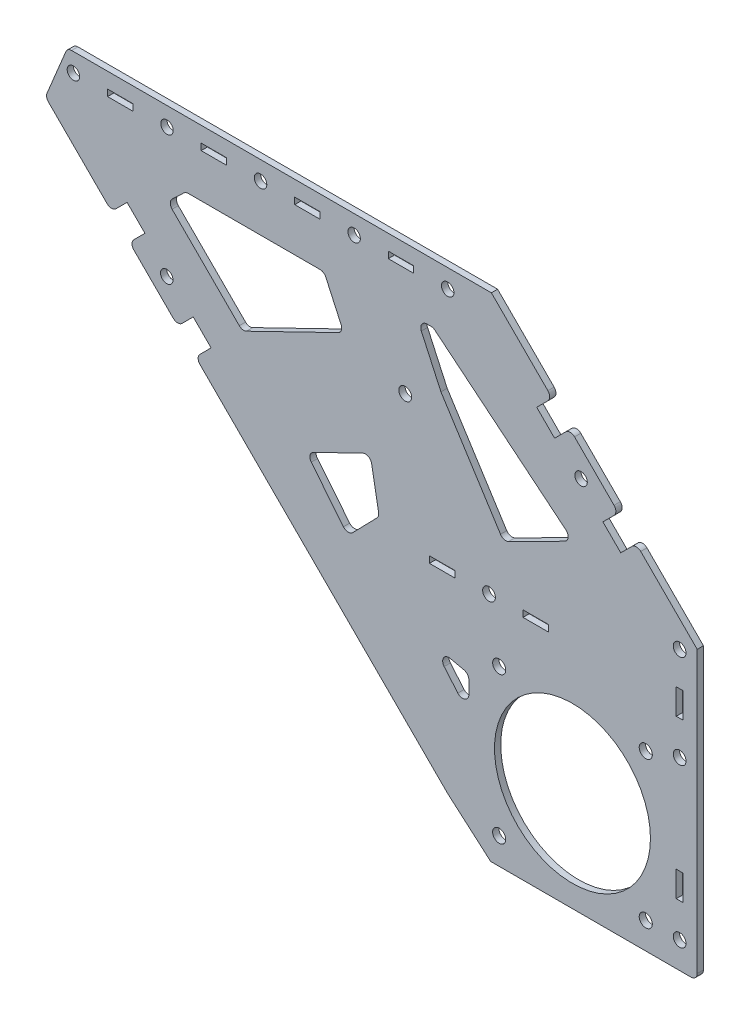
from build123d import *

# Parameters (mm, degrees)
SKETCH_1_R      = 2
SKETCH_1_R_2    = 25
SKETCH_1_R_3    = 2.05
SKETCH_1_R_4    = 2.1
SKETCH_1_W      = 8.1
SKETCH_1_H      = 2.1
SKETCH_1_W_2    = 8.2
SKETCH_1_W_3    = 2.2
SKETCH_1_H_2    = 8.2
EXTRUDE_1_DEPTH = 2
FILLET_2_R      = 2


with BuildPart() as part:
    # 草图1 → 凸台-拉伸1 (new body)
    with BuildSketch(Plane.XY):
        Polygon((7.027428163, -4.999036262), (20.810808237, -16.956988843), (73.227648339, -16.964389058), (87.027428163, -16.964389058), (87.027428163, 75.054738201), (67.497807203, 94.584359161), (63.997628636, 91.084180595), (62.512704395, 89.599256354), (56.785139468, 95.326821282), (58.270063708, 96.811745522), (61.771734574, 100.31043179), (54.027428163, 108.054738201), (46.284614051, 115.797552313), (42.784435485, 112.297373746), (41.299511244, 110.812449505), (35.571946316, 116.540014433), (37.056870557, 118.024938674), (40.557049124, 121.52511724), (21.027428163, 141.054738201), (-114.884210676, 141.054738201), (-121.955278488, 123.983670389), (-100.755816342, 102.784208243), (-97.257364322, 106.282660262), (-95.772440082, 107.767584503), (-90.044875154, 102.040019575), (-91.529799395, 100.555095335), (-95.028251414, 97.056643315), (-87.28543216, 89.313824061), (-79.542612906, 81.571004807), (-76.044160887, 85.069456827), (-74.559236646, 86.554381067), (-68.831671719, 80.82681614), (-70.316595959, 79.341891899), (-73.815047978, 75.84343988), align=None)
        with Locations((-52.972571837, 135.054738201)):
            Circle(SKETCH_1_R, mode=Mode.SUBTRACT)
        with Locations((47.027428163, 15.054738201)):
            Circle(SKETCH_1_R_2, mode=Mode.SUBTRACT)
        with Locations(Location((-22.972571837, 135.054738201, 0), (0, 0, 180))):
            Circle(SKETCH_1_R, mode=Mode.SUBTRACT)
        with Locations((7.027428163, 135.054738201)):
            Circle(SKETCH_1_R, mode=Mode.SUBTRACT)
        with Locations(Location((-112.972571837, 135.054738201, 0), (0, 0, 180))):
            Circle(SKETCH_1_R, mode=Mode.SUBTRACT)
        with Locations((-82.972571837, 135.054738201)):
            Circle(SKETCH_1_R, mode=Mode.SUBTRACT)
        with Locations((49.784787476, 103.812097514)):
            Circle(SKETCH_1_R, mode=Mode.SUBTRACT)
        with Locations((-83.04451802, 93.554738201)):
            Circle(SKETCH_1_R, mode=Mode.SUBTRACT)
        with Locations((20.275835807, 57.054738201)):
            Circle(SKETCH_1_R_3, mode=Mode.SUBTRACT)
        with Locations((-6.58531727, 99.226748532)):
            Circle(SKETCH_1_R_3, mode=Mode.SUBTRACT)
        with Locations((70.527428163, -8.445261799)):
            Circle(SKETCH_1_R_4, mode=Mode.SUBTRACT)
        with Locations((23.527428163, -8.445261799)):
            Circle(SKETCH_1_R_4, mode=Mode.SUBTRACT)
        with Locations((23.527428163, 38.554738201)):
            Circle(SKETCH_1_R_4, mode=Mode.SUBTRACT)
        with Locations((70.527428163, 38.554738201)):
            Circle(SKETCH_1_R_4, mode=Mode.SUBTRACT)
        with Locations((81.392055944, 72.204829046)):
            Circle(SKETCH_1_R_3, mode=Mode.SUBTRACT)
        with Locations((81.392055944, -8.445261799)):
            Circle(SKETCH_1_R_3, mode=Mode.SUBTRACT)
        with Locations((81.392055944, 42.204829046)):
            Circle(SKETCH_1_R_3, mode=Mode.SUBTRACT)
        with Locations((-37.972571837, 135.054738201)):
            Rectangle(SKETCH_1_W, SKETCH_1_H, mode=Mode.SUBTRACT)
        with Locations((-7.972571837, 135.054738201)):
            Rectangle(SKETCH_1_W, SKETCH_1_H, mode=Mode.SUBTRACT)
        with Locations((-97.972571837, 135.054738201)):
            Rectangle(SKETCH_1_W, SKETCH_1_H, mode=Mode.SUBTRACT)
        with Locations((-67.972571837, 135.054738201)):
            Rectangle(SKETCH_1_W, SKETCH_1_H, mode=Mode.SUBTRACT)
        with Locations((5.275835807, 57.054738201)):
            Rectangle(SKETCH_1_W_2, SKETCH_1_H, mode=Mode.SUBTRACT)
        with Locations((35.275835807, 57.054738201)):
            Rectangle(SKETCH_1_W_2, SKETCH_1_H, mode=Mode.SUBTRACT)
        Polygon((-26.317798475, 106.3059132), (-58.783300448, 90.506724064), (-82.786741677, 114.510165293), (-76.96930946, 120.054738201), (-32.606331473, 120.054738201), align=None, mode=Mode.SUBTRACT)
        Polygon((47.299709176, 85.219712632), (24.92619293, 73.952191934), (4.862626833, 105.451990707), (-2.731253041, 122.054738201), (2.37892986, 122.054738201), align=None, mode=Mode.SUBTRACT)
        Polygon((-14.950211349, 60.939664471), (-17.845757969, 77.065019133), (-38.30861977, 67.106860342), (-24.982934729, 50.626518371), align=None, mode=Mode.SUBTRACT)
        Polygon((2.01437662, 34.262984309), (13.802642778, 20.368597473), (13.802642778, 31.594822975), align=None, mode=Mode.SUBTRACT)
        with Locations((81.392055944, 57.204829046)):
            Rectangle(SKETCH_1_W_3, SKETCH_1_H_2, mode=Mode.SUBTRACT)
        with Locations((81.392055944, 6.554738201)):
            Rectangle(SKETCH_1_W_3, SKETCH_1_H_2, mode=Mode.SUBTRACT)
    extrude(amount=EXTRUDE_1_DEPTH)

    # 圆角2
    fillet_2_edges = [part.edges().sort_by_distance(p)[0] for p in [
        (-26.317798475, 106.3059132, 1),
        (-32.606331473, 120.054738201, 1),
        (-76.96930946, 120.054738201, 1),
        (-82.786741677, 114.510165293, 1),
        (-58.783300448, 90.506724064, 1),
        (47.299709176, 85.219712632, 1),
        (2.37892986, 122.054738201, 1),
        (-2.731253041, 122.054738201, 1),
        (24.92619293, 73.952191934, 1),
        (-24.982934729, 50.626518371, 1),
        (-14.950211349, 60.939664471, 1),
        (-17.845757969, 77.065019133, 1),
        (-38.30861977, 67.106860342, 1),
        (13.802642778, 31.594822975, 1),
        (2.01437662, 34.262984309, 1),
        (13.802642778, 20.368597473, 1),
        (40.557049124, 121.52511724, 1),
        (46.284614051, 115.797552313, 1),
        (61.771734574, 100.31043179, 1),
        (67.497807203, 94.584359161, 1),
        (87.027428163, -16.964389058, 1),
        (-73.815047978, 75.84343988, 1),
        (-79.542612906, 81.571004807, 1),
        (-95.028251414, 97.056643315, 1),
        (-100.755816342, 102.784208243, 1),
        (-121.955278488, 123.983670389, 1),
        (-114.884210676, 141.054738201, 1),
    ]]
    fillet(fillet_2_edges, radius=FILLET_2_R)


solid = part.part
